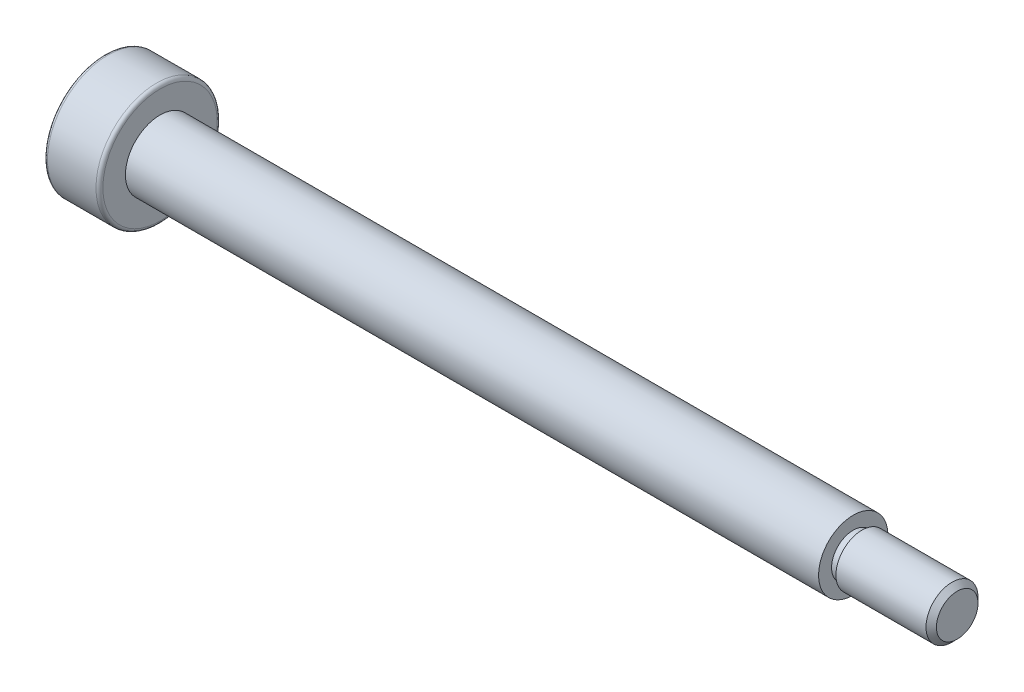
from build123d import *

# Parameters (mm, degrees)
FILLET_1_R          = 0.2
CHAMFER_1_SIZE      = 0.3
SKETCH_3_W          = 0.5
SKETCH_3_H          = 0.25
CUT_EXTRUDE_1_DEPTH = 2


with BuildPart() as part:
    # 草图1 → 旋转1 (revolve)
    with BuildSketch(Plane.XY, mode=Mode.PRIVATE) as revolve_1_sk:
        Polygon((-24.6, 0), (-24.6, 3.5), (-21.4, 3.5), (-21.4, 2), (18.6, 2), (18.6, 1.5), (24.6, 1.5), (24.6, 0), align=None)
    revolve(revolve_1_sk.sketch.rotate(Axis((-24.6, 0, 0), (1, 0, 0)), 90), axis=Axis((-24.6, 0, 0), (1, 0, 0)))

    # 圆角1
    fillet_1_edges = [part.edges().sort_by_distance(p)[0] for p in [
        (-21.4, 0, -3.5),
        (-24.6, 0, -3.5),
    ]]
    fillet(fillet_1_edges, radius=FILLET_1_R)

    # 倒角1
    chamfer_1_edges = [part.edges().sort_by_distance(p)[0] for p in [
        (24.6, 0, -1.5),
    ]]
    chamfer(chamfer_1_edges, length=CHAMFER_1_SIZE)

    # 草图3 → 切除-旋转1 (revolve, cut)
    with BuildSketch(Plane.XY, mode=Mode.PRIVATE) as cut_revolve_1_sk:
        with Locations((18.85, 1.375)):
            Rectangle(SKETCH_3_W, SKETCH_3_H)
    revolve(cut_revolve_1_sk.sketch.rotate(Axis((18.6, 0, 0), (1, 0, 0)), 90), axis=Axis((18.6, 0, 0), (1, 0, 0)), mode=Mode.SUBTRACT)

    # 草图4 → 切除-拉伸1 (cut)
    with BuildSketch(Plane.ZY.offset(24.6)):
        Polygon((1.732050808, 0), (0.866025404, 1.5), (-0.866025404, 1.5), (-1.732050808, 0), (-0.866025404, -1.5), (0.866025404, -1.5), align=None)
    extrude(amount=-CUT_EXTRUDE_1_DEPTH, mode=Mode.SUBTRACT)


solid = part.part
